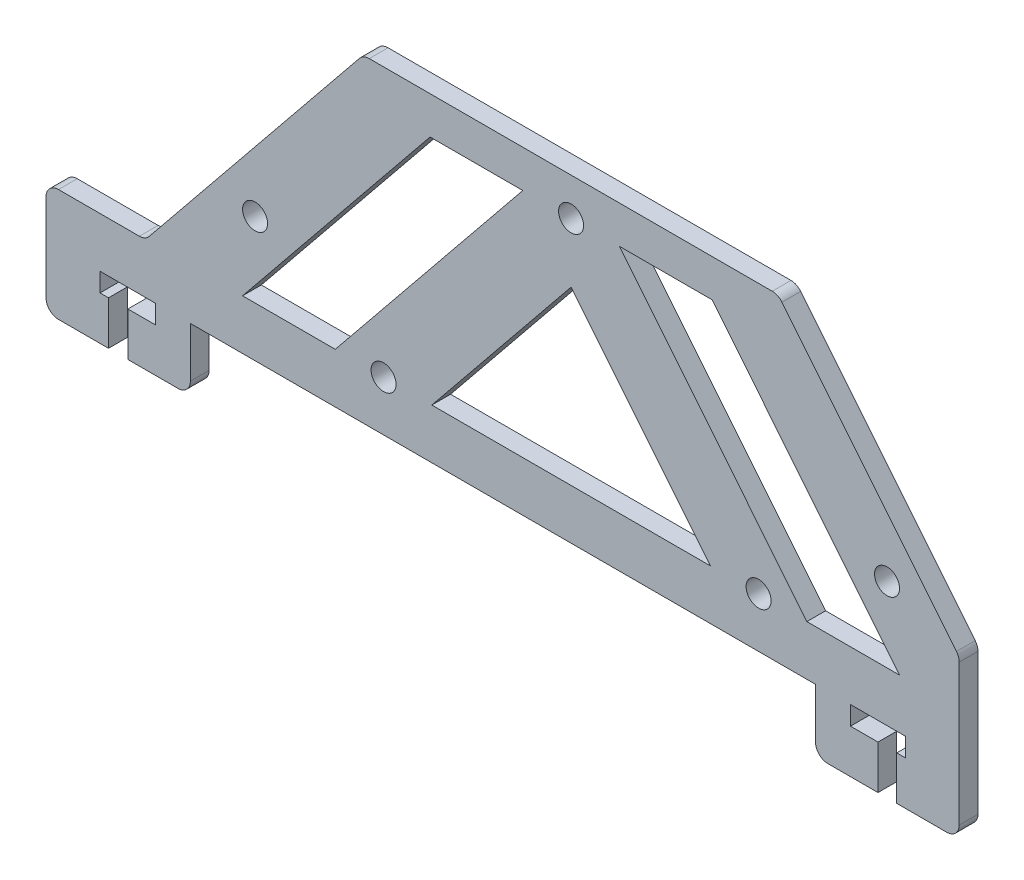
from build123d import *

# Parameters (mm, degrees)
SKETCH_1_R      = 1
EXTRUDE_1_DEPTH = 1.5
FILLET_1_R      = 1


with BuildPart() as part:
    # 草图1 → 凸台-拉伸1 (new body)
    with BuildSketch(Plane.XY):
        Polygon((64.3, -0.39974336), (59.3, -0.39974336), (59.3, 3.10025664), (60, 3.10025664), (60, 4.60025664), (55.6, 4.60025664), (55.6, 3.10025664), (57.8, 3.10025664), (57.8, -0.39974336), (52.8, -0.39974336), (52.8, 4.60025664), (2.8, 4.60025664), (2.8, -0.39974336), (-2.2, -0.39974336), (-2.2, 3.10025664), (0, 3.10025664), (0, 4.60025664), (-4.42519, 4.60025664), (-4.42519, 3.10025664), (-3.75, 3.10025664), (-3.75, -0.39974336), (-8.75, -0.39974336), (-8.75, 8.60025664), (-0.803608582, 8.60025664), (16.62882385, 30.10025664), (34.845120873, 30.10025664), (49.819650388, 30.10025664), (64.3, 12.241158786), align=None)
        with Locations((33.25, 27.10025664)):
            Circle(SKETCH_1_R, mode=Mode.SUBTRACT)
        with Locations((48.25, 8.60025664)):
            Circle(SKETCH_1_R, mode=Mode.SUBTRACT)
        with Locations((18.25, 8.60025664)):
            Circle(SKETCH_1_R, mode=Mode.SUBTRACT)
        with Locations((58.525, 14.60025664)):
            Circle(SKETCH_1_R, mode=Mode.SUBTRACT)
        with Locations(Location((7.975, 14.60025664, 0), (0, 0, 180))):
            Circle(SKETCH_1_R, mode=Mode.SUBTRACT)
        Polygon((59.527646909, 8.60025664), (52.112217956, 8.60025664), (37.112217956, 27.10025664), (44.527646909, 27.10025664), align=None, mode=Mode.SUBTRACT)
        Polygon((44.387782044, 8.60025664), (33.25, 22.336854495), (22.112217956, 8.60025664), align=None, mode=Mode.SUBTRACT)
        Polygon((21.972353091, 27.10025664), (29.387782044, 27.10025664), (14.387782044, 8.60025664), (6.972353091, 8.60025664), align=None, mode=Mode.SUBTRACT)
    extrude(amount=EXTRUDE_1_DEPTH)

    # 圆角1
    fillet_1_edges = [part.edges().sort_by_distance(p)[0] for p in [
        (64.3, -0.39974336, 0.75),
        (52.8, -0.39974336, 0.75),
        (2.8, -0.39974336, 0.75),
        (-8.75, -0.39974336, 0.75),
        (-8.75, 8.60025664, 0.75),
        (-0.803608582, 8.60025664, 0.75),
        (16.62882385, 30.10025664, 0.75),
        (49.819650388, 30.10025664, 0.75),
        (64.3, 12.241158786, 0.75),
    ]]
    fillet(fillet_1_edges, radius=FILLET_1_R)


solid = part.part
